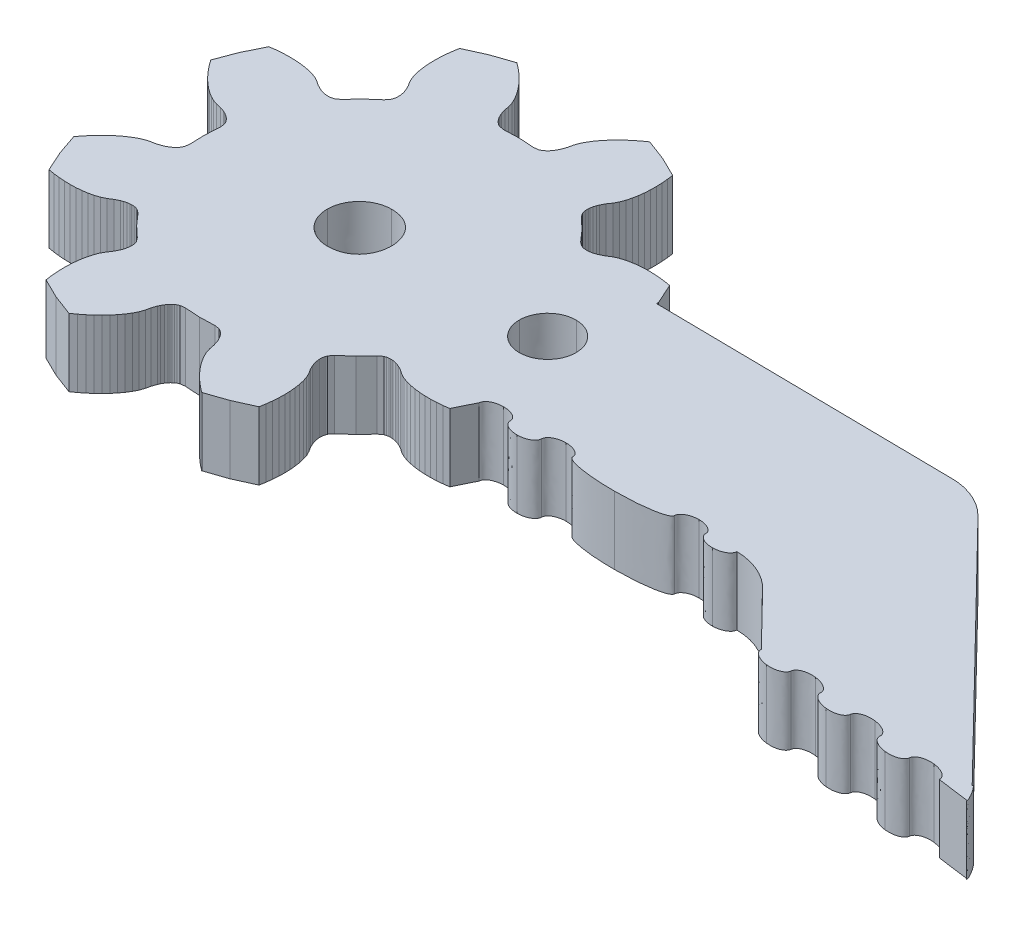
from build123d import *

# Parameters (mm, degrees)
BOSS_EXTRUDE1_DEPTH = 3.175


with BuildPart() as part:
    # Sketch1 → Boss-Extrude1 (new body)
    with BuildSketch(Plane(origin=(0, 0, 0), x_dir=(1, 0, 0), z_dir=(0, 1, 0))):
        with BuildLine():
            Line((118.534060584, 166.096137226), (118.534060584, 166.193037226))
            Line((118.534060584, 166.193037226), (118.108060584, 167.134537226))
            Line((118.108060584, 167.134537226), (117.826560584, 167.181137226))
            Line((117.826560584, 167.181137226), (117.549360584, 167.214137226))
            Line((117.549360584, 167.214137226), (117.276960584, 167.233637226))
            Line((117.276960584, 167.233637226), (117.010060584, 167.239237226))
            Line((117.010060584, 167.239237226), (116.749260584, 167.230937226))
            Line((116.749260584, 167.230937226), (116.495560584, 167.208237226))
            Line((116.495560584, 167.208237226), (116.249660584, 167.170437226))
            Line((116.249660584, 167.170437226), (116.013260584, 167.116437226))
            Line((116.013260584, 167.116437226), (115.788260584, 167.043537226))
            Line((115.788260584, 167.043537226), (115.582360584, 166.941537226))
            Line((115.582360584, 166.941537226), (115.390360584, 166.818437226))
            Line((115.390360584, 166.818437226), (115.183560584, 166.717437226))
            Line((115.183560584, 166.717437226), (115.073160584, 166.677237226))
            Line((115.073160584, 166.677237226), (114.956660584, 166.645637226))
            Line((114.956660584, 166.645637226), (114.832260584, 166.625337226))
            Line((114.832260584, 166.625337226), (114.765960584, 166.620637226))
            Line((114.765960584, 166.620637226), (114.695960584, 166.620837226))
            Line((114.695960584, 166.620837226), (114.621060584, 166.627637226))
            Line((114.621060584, 166.627637226), (114.538460584, 166.644337226))
            Line((114.538460584, 166.644337226), (114.441560584, 166.679237226))
            Line((114.441560584, 166.679237226), (114.261560584, 166.818637226))
            Line((114.261560584, 166.818637226), (113.795260584, 167.348437226))
            Line((113.795260584, 167.348437226), (113.280360584, 167.831137226))
            Line((113.280360584, 167.831137226), (113.146760584, 168.015437226))
            Line((113.146760584, 168.015437226), (113.114860584, 168.113337226))
            Line((113.114860584, 168.113337226), (113.100760584, 168.196437226))
            Line((113.100760584, 168.196437226), (113.096260584, 168.271637226))
            Line((113.096260584, 168.271637226), (113.098260584, 168.341537226))
            Line((113.098260584, 168.341537226), (113.105060584, 168.407637226))
            Line((113.105060584, 168.407637226), (113.129260584, 168.531337226))
            Line((113.129260584, 168.531337226), (113.164460584, 168.646837226))
            Line((113.164460584, 168.646837226), (113.208160584, 168.755937226))
            Line((113.208160584, 168.755937226), (113.315660584, 168.959437226))
            Line((113.315660584, 168.959437226), (113.444660584, 169.147437226))
            Line((113.444660584, 169.147437226), (113.553160584, 169.350037226))
            Line((113.553160584, 169.350037226), (113.632960584, 169.572637226))
            Line((113.632960584, 169.572637226), (113.694460584, 169.807237226))
            Line((113.694460584, 169.807237226), (113.739960584, 170.051737226))
            Line((113.739960584, 170.051737226), (113.770560584, 170.304737226))
            Line((113.770560584, 170.304737226), (113.787060584, 170.565037226))
            Line((113.787060584, 170.565037226), (113.789860584, 170.832037226))
            Line((113.789860584, 170.832037226), (113.778960584, 171.104937226))
            Line((113.778960584, 171.104937226), (113.754660584, 171.383037226))
            Line((113.754660584, 171.383037226), (113.716960584, 171.665837226))
            Line((113.716960584, 171.665837226), (112.789260584, 172.121237226))
            Line((112.789260584, 172.121237226), (111.822260584, 172.485737226))
            Line((111.822260584, 172.485737226), (111.590260584, 172.319637226))
            Line((111.590260584, 172.319637226), (111.370960584, 172.146937226))
            Line((111.370960584, 172.146937226), (111.164560584, 171.968137226))
            Line((111.164560584, 171.968137226), (110.971760584, 171.783337226))
            Line((110.971760584, 171.783337226), (110.793360584, 171.593037226))
            Line((110.793360584, 171.593037226), (110.629960584, 171.397537226))
            Line((110.629960584, 171.397537226), (110.482860584, 171.197037226))
            Line((110.482860584, 171.197037226), (110.353860584, 170.991637226))
            Line((110.353860584, 170.991637226), (110.246360584, 170.781037226))
            Line((110.246360584, 170.781037226), (110.172760584, 170.563337226))
            Line((110.172760584, 170.563337226), (110.124060584, 170.340537226))
            Line((110.124060584, 170.340537226), (110.049260584, 170.122837226))
            Line((110.049260584, 170.122837226), (109.999660584, 170.016337226))
            Line((109.999660584, 170.016337226), (109.939660584, 169.911637226))
            Line((109.939660584, 169.911637226), (109.866060584, 169.809237226))
            Line((109.866060584, 169.809237226), (109.822460584, 169.759037226))
            Line((109.822460584, 169.759037226), (109.772860584, 169.709737226))
            Line((109.772860584, 169.709737226), (109.714960584, 169.661537226))
            Line((109.714960584, 169.661537226), (109.644760584, 169.615037226))
            Line((109.644760584, 169.615037226), (109.551560584, 169.571237226))
            Line((109.551560584, 169.571237226), (109.325760584, 169.542437226))
            Line((109.325760584, 169.542437226), (108.621460584, 169.587337226))
            Line((108.621460584, 169.587337226), (107.916060584, 169.564637226))
            Line((107.916060584, 169.564637226), (107.691160584, 169.600437226))
            Line((107.691160584, 169.600437226), (107.599460584, 169.647137226))
            Line((107.599460584, 169.647137226), (107.530660584, 169.695937226))
            Line((107.530660584, 169.695937226), (107.474460584, 169.745937226))
            Line((107.474460584, 169.745937226), (107.426360584, 169.796737226))
            Line((107.426360584, 169.796737226), (107.384360584, 169.848237226))
            Line((107.384360584, 169.848237226), (107.314060584, 169.952937226))
            Line((107.314060584, 169.952937226), (107.257360584, 170.059437226))
            Line((107.257360584, 170.059437226), (107.211060584, 170.167437226))
            Line((107.211060584, 170.167437226), (107.143160584, 170.387337226))
            Line((107.143160584, 170.387337226), (107.101460584, 170.611537226))
            Line((107.101460584, 170.611537226), (107.034860584, 170.831537226))
            Line((107.034860584, 170.831537226), (106.933960584, 171.045337226))
            Line((106.933960584, 171.045337226), (106.811560584, 171.254737226))
            Line((106.811560584, 171.254737226), (106.670760584, 171.459737226))
            Line((106.670760584, 171.459737226), (106.513560584, 171.660337226))
            Line((106.513560584, 171.660337226), (106.341160584, 171.856037226))
            Line((106.341160584, 171.856037226), (106.154260584, 172.046737226))
            Line((106.154260584, 172.046737226), (105.953660584, 172.232037226))
            Line((105.953660584, 172.232037226), (105.739860584, 172.411537226))
            Line((105.739860584, 172.411537226), (105.513260584, 172.584837226))
            Line((105.513260584, 172.584837226), (104.535260584, 172.250837226))
            Line((104.535260584, 172.250837226), (103.593660584, 171.824837226))
            Line((103.593660584, 171.824837226), (103.547160584, 171.543337226))
            Line((103.547160584, 171.543337226), (103.514060584, 171.266137226))
            Line((103.514060584, 171.266137226), (103.494660584, 170.993737226))
            Line((103.494660584, 170.993737226), (103.488960584, 170.726837226))
            Line((103.488960584, 170.726837226), (103.497360584, 170.466137226))
            Line((103.497360584, 170.466137226), (103.519960584, 170.212237226))
            Line((103.519960584, 170.212237226), (103.557760584, 169.966537226))
            Line((103.557760584, 169.966537226), (103.611860584, 169.730037226))
            Line((103.611860584, 169.730037226), (103.684660584, 169.505137226))
            Line((103.684660584, 169.505137226), (103.786660584, 169.299137226))
            Line((103.786660584, 169.299137226), (103.909860584, 169.107137226))
            Line((103.909860584, 169.107137226), (104.010760584, 168.900337226))
            Line((104.010760584, 168.900337226), (104.051060584, 168.789937226))
            Line((104.051060584, 168.789937226), (104.082560584, 168.673537226))
            Line((104.082560584, 168.673537226), (104.102960584, 168.549037226))
            Line((104.102960584, 168.549037226), (104.107660584, 168.482737226))
            Line((104.107660584, 168.482737226), (104.107460584, 168.412737226))
            Line((104.107460584, 168.412737226), (104.100560584, 168.337837226))
            Line((104.100560584, 168.337837226), (104.083860584, 168.255237226))
            Line((104.083860584, 168.255237226), (104.048960584, 168.158337226))
            Line((104.048960584, 168.158337226), (103.909560584, 167.978337226))
            Line((103.909560584, 167.978337226), (103.379860584, 167.512037226))
            Line((103.379860584, 167.512037226), (102.897160584, 166.997137226))
            Line((102.897160584, 166.997137226), (102.712860584, 166.863537226))
            Line((102.712860584, 166.863537226), (102.614860584, 166.831637226))
            Line((102.614860584, 166.831637226), (102.531760584, 166.817537226))
            Line((102.531760584, 166.817537226), (102.456660584, 166.813137226))
            Line((102.456660584, 166.813137226), (102.386760584, 166.815037226))
            Line((102.386760584, 166.815037226), (102.320660584, 166.821837226))
            Line((102.320660584, 166.821837226), (102.196860584, 166.846137226))
            Line((102.196860584, 166.846137226), (102.081460584, 166.881337226))
            Line((102.081460584, 166.881337226), (101.972360584, 166.924937226))
            Line((101.972360584, 166.924937226), (101.768860584, 167.032437226))
            Line((101.768860584, 167.032437226), (101.580860584, 167.161537226))
            Line((101.580860584, 167.161537226), (101.378160584, 167.269937226))
            Line((101.378160584, 167.269937226), (101.155660584, 167.349837226))
            Line((101.155660584, 167.349837226), (100.920960584, 167.411237226))
            Line((100.920960584, 167.411237226), (100.676460584, 167.456737226))
            Line((100.676460584, 167.456737226), (100.423560584, 167.487437226))
            Line((100.423560584, 167.487437226), (100.163160584, 167.503937226))
            Line((100.163160584, 167.503937226), (99.896260584, 167.506637226))
            Line((99.896260584, 167.506637226), (99.623360584, 167.495737226))
            Line((99.623360584, 167.495737226), (99.345260584, 167.471437226))
            Line((99.345260584, 167.471437226), (99.062460584, 167.433737226))
            Line((99.062460584, 167.433737226), (98.607060584, 166.506037226))
            Line((98.607060584, 166.506037226), (98.242560584, 165.539037226))
            Line((98.242560584, 165.539037226), (98.408660584, 165.307137226))
            Line((98.408660584, 165.307137226), (98.581260584, 165.087737226))
            Line((98.581260584, 165.087737226), (98.760160584, 164.881337226))
            Line((98.760160584, 164.881337226), (98.944860584, 164.688637226))
            Line((98.944860584, 164.688637226), (99.135160584, 164.510137226))
            Line((99.135160584, 164.510137226), (99.330660584, 164.346737226))
            Line((99.330660584, 164.346737226), (99.531160584, 164.199637226))
            Line((99.531160584, 164.199637226), (99.736660584, 164.070637226))
            Line((99.736660584, 164.070637226), (99.947160584, 163.963137226))
            Line((99.947160584, 163.963137226), (100.164960584, 163.889537226))
            Line((100.164960584, 163.889537226), (100.387760584, 163.840937226))
            Line((100.387760584, 163.840937226), (100.605360584, 163.766137226))
            Line((100.605360584, 163.766137226), (100.711860584, 163.716537226))
            Line((100.711860584, 163.716537226), (100.816560584, 163.656437226))
            Line((100.816560584, 163.656437226), (100.918960584, 163.582837226))
            Line((100.918960584, 163.582837226), (100.969160584, 163.539237226))
            Line((100.969160584, 163.539237226), (101.018460584, 163.489637226))
            Line((101.018460584, 163.489637226), (101.066660584, 163.431837226))
            Line((101.066660584, 163.431837226), (101.113260584, 163.361537226))
            Line((101.113260584, 163.361537226), (101.157060584, 163.268337226))
            Line((101.157060584, 163.268337226), (101.185760584, 163.042537226))
            Line((101.185760584, 163.042537226), (101.140860584, 162.338237226))
            Line((101.140860584, 162.338237226), (101.163660584, 161.632837226))
            Line((101.163660584, 161.632837226), (101.127860584, 161.408037226))
            Line((101.127860584, 161.408037226), (101.081160584, 161.316237226))
            Line((101.081160584, 161.316237226), (101.032360584, 161.247537226))
            Line((101.032360584, 161.247537226), (100.982360584, 161.191237226))
            Line((100.982360584, 161.191237226), (100.931560584, 161.143137226))
            Line((100.931560584, 161.143137226), (100.879960584, 161.101237226))
            Line((100.879960584, 161.101237226), (100.775260584, 161.030837226))
            Line((100.775260584, 161.030837226), (100.668860584, 160.974137226))
            Line((100.668860584, 160.974137226), (100.560760584, 160.927837226))
            Line((100.560760584, 160.927837226), (100.340960584, 160.859937226))
            Line((100.340960584, 160.859937226), (100.116660584, 160.818337226))
            Line((100.116660584, 160.818337226), (99.896760584, 160.751637226))
            Line((99.896760584, 160.751637226), (99.682860584, 160.650737226))
            Line((99.682860584, 160.650737226), (99.473560584, 160.528337226))
            Line((99.473560584, 160.528337226), (99.268460584, 160.387637226))
            Line((99.268460584, 160.387637226), (99.067960584, 160.230437226))
            Line((99.067960584, 160.230437226), (98.872160584, 160.057937226))
            Line((98.872160584, 160.057937226), (98.681460584, 159.871137226))
            Line((98.681460584, 159.871137226), (98.496160584, 159.670437226))
            Line((98.496160584, 159.670437226), (98.316660584, 159.456637226))
            Line((98.316660584, 159.456637226), (98.143460584, 159.230037226))
            Line((98.143460584, 159.230037226), (98.477360584, 158.252037226))
            Line((98.477360584, 158.252037226), (98.903360584, 157.310437226))
            Line((98.903360584, 157.310437226), (99.184860584, 157.263937226))
            Line((99.184860584, 157.263937226), (99.462060584, 157.230837226))
            Line((99.462060584, 157.230837226), (99.734460584, 157.211437226))
            Line((99.734460584, 157.211437226), (100.001460584, 157.205837226))
            Line((100.001460584, 157.205837226), (100.262160584, 157.214137226))
            Line((100.262160584, 157.214137226), (100.515960584, 157.236837226))
            Line((100.515960584, 157.236837226), (100.761760584, 157.274537226))
            Line((100.761760584, 157.274537226), (100.998260584, 157.328637226))
            Line((100.998260584, 157.328637226), (101.223160584, 157.401537226))
            Line((101.223160584, 157.401537226), (101.429160584, 157.503537226))
            Line((101.429160584, 157.503537226), (101.621060584, 157.626637226))
            Line((101.621060584, 157.626637226), (101.827860584, 157.727637226))
            Line((101.827860584, 157.727637226), (101.938260584, 157.767837226))
            Line((101.938260584, 157.767837226), (102.054760584, 157.799437226))
            Line((102.054760584, 157.799437226), (102.179260584, 157.819737226))
            Line((102.179260584, 157.819737226), (102.245460584, 157.824437226))
            Line((102.245460584, 157.824437226), (102.315460584, 157.824237226))
            Line((102.315460584, 157.824237226), (102.390460584, 157.817437226))
            Line((102.390460584, 157.817437226), (102.473060584, 157.800737226))
            Line((102.473060584, 157.800737226), (102.569860584, 157.765737226))
            Line((102.569860584, 157.765737226), (102.749860584, 157.626437226))
            Line((102.749860584, 157.626437226), (103.216260584, 157.096637226))
            Line((103.216260584, 157.096637226), (103.731060584, 156.613937226))
            Line((103.731060584, 156.613937226), (103.864760584, 156.429637226))
            Line((103.864760584, 156.429637226), (103.896560584, 156.331737226))
            Line((103.896560584, 156.331737226), (103.910660584, 156.248637226))
            Line((103.910660584, 156.248637226), (103.915160584, 156.173437226))
            Line((103.915160584, 156.173437226), (103.913160584, 156.103537226))
            Line((103.913160584, 156.103537226), (103.906460584, 156.037437226))
            Line((103.906460584, 156.037437226), (103.882160584, 155.913637226))
            Line((103.882160584, 155.913637226), (103.846960584, 155.798237226))
            Line((103.846960584, 155.798237226), (103.803260584, 155.689137226))
            Line((103.803260584, 155.689137226), (103.695860584, 155.485637226))
            Line((103.695860584, 155.485637226), (103.566760584, 155.297637226))
            Line((103.566760584, 155.297637226), (103.458360584, 155.094937226))
            Line((103.458360584, 155.094937226), (103.378460584, 154.872437226))
            Line((103.378460584, 154.872437226), (103.316960584, 154.637837226))
            Line((103.316960584, 154.637837226), (103.271460584, 154.393337226))
            Line((103.271460584, 154.393337226), (103.240860584, 154.140337226))
            Line((103.240860584, 154.140337226), (103.224360584, 153.879937226))
            Line((103.224360584, 153.879937226), (103.221660584, 153.613037226))
            Line((103.221660584, 153.613037226), (103.232460584, 153.340137226))
            Line((103.232460584, 153.340137226), (103.256760584, 153.062037226))
            Line((103.256760584, 153.062037226), (103.294460584, 152.779237226))
            Line((103.294460584, 152.779237226), (104.222160584, 152.323837226))
            Line((104.222160584, 152.323837226), (105.189160584, 151.959337226))
            Line((105.189160584, 151.959337226), (105.421160584, 152.125437226))
            Line((105.421160584, 152.125437226), (105.640560584, 152.298037226))
            Line((105.640560584, 152.298037226), (105.846860584, 152.476937226))
            Line((105.846860584, 152.476937226), (106.039660584, 152.661737226))
            Line((106.039660584, 152.661737226), (106.218160584, 152.851937226))
            Line((106.218160584, 152.851937226), (106.381560584, 153.047437226))
            Line((106.381560584, 153.047437226), (106.528660584, 153.248037226))
            Line((106.528660584, 153.248037226), (106.657560584, 153.453437226))
            Line((106.657560584, 153.453437226), (106.765160584, 153.663937226))
            Line((106.765160584, 153.663937226), (106.838660584, 153.881737226))
            Line((106.838660584, 153.881737226), (106.887360584, 154.104537226))
            Line((106.887360584, 154.104537226), (106.962160584, 154.322137226))
            Line((106.962160584, 154.322137226), (107.011760584, 154.428637226))
            Line((107.011760584, 154.428637226), (107.071860584, 154.533337226))
            Line((107.071860584, 154.533337226), (107.145460584, 154.635837226))
            Line((107.145460584, 154.635837226), (107.188960584, 154.685937226))
            Line((107.188960584, 154.685937226), (107.238560584, 154.735237226))
            Line((107.238560584, 154.735237226), (107.296460584, 154.783437226))
            Line((107.296460584, 154.783437226), (107.366660584, 154.830037226))
            Line((107.366660584, 154.830037226), (107.459860584, 154.873837226))
            Line((107.459860584, 154.873837226), (107.685660584, 154.902637226))
            Line((107.685660584, 154.902637226), (108.390060584, 154.857737226))
            Line((108.390060584, 154.857737226), (109.095460584, 154.880437226))
            Line((109.095460584, 154.880437226), (109.320260584, 154.844637226))
            Line((109.320260584, 154.844637226), (109.412060584, 154.797937226))
            Line((109.412060584, 154.797937226), (109.480760584, 154.749137226))
            Line((109.480760584, 154.749137226), (109.537060584, 154.699137226))
            Line((109.537060584, 154.699137226), (109.585060584, 154.648337226))
            Line((109.585060584, 154.648337226), (109.627060584, 154.596837226))
            Line((109.627060584, 154.596837226), (109.697360584, 154.492137226))
            Line((109.697360584, 154.492137226), (109.754160584, 154.385637226))
            Line((109.754160584, 154.385637226), (109.800360584, 154.277537226))
            Line((109.800360584, 154.277537226), (109.868360584, 154.057737226))
            Line((109.868360584, 154.057737226), (109.909960584, 153.833537226))
            Line((109.909960584, 153.833537226), (109.976660584, 153.613537226))
            Line((109.976660584, 153.613537226), (110.077460584, 153.399737226))
            Line((110.077460584, 153.399737226), (110.199960584, 153.190337226))
            Line((110.199960584, 153.190337226), (110.340660584, 152.985237226))
            Line((110.340660584, 152.985237226), (110.497860584, 152.784737226))
            Line((110.497860584, 152.784737226), (110.670260584, 152.588937226))
            Line((110.670260584, 152.588937226), (110.857160584, 152.398237226))
            Line((110.857160584, 152.398237226), (111.057760584, 152.213037226))
            Line((111.057760584, 152.213037226), (111.271660584, 152.033537226))
            Line((111.271660584, 152.033537226), (111.498260584, 151.860237226))
            Line((111.498260584, 151.860237226), (112.476260584, 152.194137226))
            Line((112.476260584, 152.194137226), (113.417760584, 152.620237226))
            Line((113.417760584, 152.620237226), (113.464360584, 152.901637226))
            Line((113.464360584, 152.901637226), (113.497360584, 153.178937226))
            Line((113.497360584, 153.178937226), (113.516760584, 153.451337226))
            Line((113.516760584, 153.451337226), (113.522460584, 153.718237226))
            Line((113.522460584, 153.718237226), (113.514160584, 153.978937226))
            Line((113.514160584, 153.978937226), (113.491460584, 154.232737226))
            Line((113.491460584, 154.232737226), (113.453660584, 154.478537226))
            Line((113.453660584, 154.478537226), (113.399560584, 154.715037226))
            Line((113.399560584, 154.715037226), (113.326760584, 154.939937226))
            Line((113.326760584, 154.939937226), (113.224760584, 155.145937226))
            Line((113.224760584, 155.145937226), (113.101660584, 155.337837226))
            Line((113.101660584, 155.337837226), (113.000660584, 155.544637226))
            Line((113.000660584, 155.544637226), (112.960360584, 155.655037226))
            Line((112.960360584, 155.655037226), (112.928860584, 155.771537226))
            Line((112.928860584, 155.771537226), (112.908460584, 155.896037226))
            Line((112.908460584, 155.896037226), (112.903760584, 155.962337226))
            Line((112.903760584, 155.962337226), (112.904060584, 156.032237226))
            Line((112.904060584, 156.032237226), (112.910860584, 156.107237226))
            Line((112.910860584, 156.107237226), (112.927560584, 156.189837226))
            Line((112.927560584, 156.189837226), (112.962460584, 156.286637226))
            Line((112.962460584, 156.286637226), (113.101860584, 156.466737226))
            Line((113.101860584, 156.466737226), (113.631560584, 156.933037226))
            Line((113.631560584, 156.933037226), (114.114360584, 157.447837226))
            Line((114.114360584, 157.447837226), (114.298660584, 157.581537226))
            Line((114.298660584, 157.581537226), (114.396560584, 157.613337226))
            Line((114.396560584, 157.613337226), (114.479660584, 157.627537226))
            Line((114.479660584, 157.627537226), (114.554760584, 157.631937226))
            Line((114.554760584, 157.631937226), (114.624660584, 157.630037226))
            Line((114.624660584, 157.630037226), (114.690760584, 157.623237226))
            Line((114.690760584, 157.623237226), (114.814560584, 157.598937226))
            Line((114.814560584, 157.598937226), (114.930060584, 157.563737226))
            Line((114.930060584, 157.563737226), (115.039160584, 157.520037226))
            Line((115.039160584, 157.520037226), (115.242560584, 157.412637226))
            Line((115.242560584, 157.412637226), (115.430660584, 157.283537226))
            Line((115.430660584, 157.283537226), (115.633260584, 157.175137226))
            Line((115.633260584, 157.175137226), (115.855760584, 157.095237226))
            Line((115.855760584, 157.095237226), (116.090460584, 157.033737226))
            Line((116.090460584, 157.033737226), (116.334960584, 156.988337226))
            Line((116.334960584, 156.988337226), (116.587860584, 156.957637226))
            Line((116.587860584, 156.957637226), (116.848260584, 156.941137226))
            Line((116.848260584, 156.941137226), (117.115260584, 156.938437226))
            Line((117.115260584, 156.938437226), (117.388060584, 156.949237226))
            Line((117.388060584, 156.949237226), (117.666260584, 156.973637226))
            Line((117.666260584, 156.973637226), (117.948960584, 157.011237226))
            Line((117.948960584, 157.011237226), (118.404460584, 157.938937226))
            Line((118.404460584, 157.938937226), (118.404460584, 157.925837226))
            add(Edge.make_bspline(
                [(118.404460584, 157.925837226), (118.407660584, 158.153937226), (118.736960584, 158.338837226), (119.139860584, 158.338837226)],
                knots=[0.902506964, 0.902506964, 0.902506964, 0.902506964, 0.905292479, 0.905292479, 0.905292479, 0.905292479], degree=3))
            add(Edge.make_bspline(
                [(119.139860584, 158.338837226), (119.542860584, 158.338837226), (119.866860584, 158.153937226), (119.863760584, 157.925837226)],
                knots=[0.905292479, 0.905292479, 0.905292479, 0.905292479, 0.908077994, 0.908077994, 0.908077994, 0.908077994], degree=3))
            add(Edge.make_bspline(
                [(119.863760584, 157.925837226), (119.860560584, 157.697737226), (120.184560584, 157.512837226), (120.587560584, 157.512837226)],
                knots=[0.908077994, 0.908077994, 0.908077994, 0.908077994, 0.91086351, 0.91086351, 0.91086351, 0.91086351], degree=3))
            add(Edge.make_bspline(
                [(120.587560584, 157.512837226), (120.990460584, 157.512837226), (121.319760584, 157.697737226), (121.323060584, 157.925837226)],
                knots=[0.91086351, 0.91086351, 0.91086351, 0.91086351, 0.913649025, 0.913649025, 0.913649025, 0.913649025], degree=3))
            add(Edge.make_bspline(
                [(121.323060584, 157.925837226), (121.326260584, 158.153937226), (121.655460584, 158.338837226), (122.058460584, 158.338837226)],
                knots=[0.913649025, 0.913649025, 0.913649025, 0.913649025, 0.91643454, 0.91643454, 0.91643454, 0.91643454], degree=3))
            add(Edge.make_bspline(
                [(122.058460584, 158.338837226), (122.461360584, 158.338837226), (122.785460584, 158.153937226), (122.782460584, 157.925837226)],
                knots=[0.91643454, 0.91643454, 0.91643454, 0.91643454, 0.919220056, 0.919220056, 0.919220056, 0.919220056], degree=3))
            add(Edge.make_bspline(
                [(122.782460584, 157.925837226), (122.772160584, 157.697637226), (123.829060584, 157.512737226), (125.143160584, 157.512737226)],
                knots=[0.919220056, 0.919220056, 0.919220056, 0.919220056, 0.922005571, 0.922005571, 0.922005571, 0.922005571], degree=3))
            add(Edge.make_bspline(
                [(125.143160584, 157.512737226), (126.457260584, 157.512737226), (127.531060584, 157.697637226), (127.541560584, 157.925837226)],
                knots=[0.922005571, 0.922005571, 0.922005571, 0.922005571, 0.924791086, 0.924791086, 0.924791086, 0.924791086], degree=3))
            add(Edge.make_bspline(
                [(127.541560584, 157.925837226), (127.544760584, 158.153837226), (127.873960584, 158.338737226), (128.276960584, 158.338737226)],
                knots=[0.924791086, 0.924791086, 0.924791086, 0.924791086, 0.927576602, 0.927576602, 0.927576602, 0.927576602], degree=3))
            add(Edge.make_bspline(
                [(128.276960584, 158.338737226), (128.679860584, 158.338737226), (129.003960584, 158.153837226), (129.000760584, 157.925737226)],
                knots=[0.927576602, 0.927576602, 0.927576602, 0.927576602, 0.930362117, 0.930362117, 0.930362117, 0.930362117], degree=3))
            add(Edge.make_bspline(
                [(129.000760584, 157.925737226), (128.997560584, 157.697637226), (129.321660584, 157.512737226), (129.724560584, 157.512737226)],
                knots=[0.930362117, 0.930362117, 0.930362117, 0.930362117, 0.933147632, 0.933147632, 0.933147632, 0.933147632], degree=3))
            add(Edge.make_bspline(
                [(129.724560584, 157.512737226), (130.127560584, 157.512737226), (130.456760584, 157.697637226), (130.459960584, 157.925737226)],
                knots=[0.933147632, 0.933147632, 0.933147632, 0.933147632, 0.935933148, 0.935933148, 0.935933148, 0.935933148], degree=3))
            add(Edge.make_bspline(
                [(130.459960584, 157.925737226), (131.255560584, 157.915837226), (132.014660584, 157.590237226), (132.570260584, 157.020737226)],
                knots=[0.935933148, 0.935933148, 0.935933148, 0.935933148, 0.938718663, 0.938718663, 0.938718663, 0.938718663], degree=3))
            Line((132.570260584, 157.020737226), (134.988060584, 154.541837226))
            add(Edge.make_bspline(
                [(134.988060584, 154.541837226), (134.964860584, 154.314837226), (135.298060584, 154.089537226), (135.732260584, 154.038337226)],
                knots=[0.941504178, 0.941504178, 0.941504178, 0.941504178, 0.944289694, 0.944289694, 0.944289694, 0.944289694], degree=3))
            add(Edge.make_bspline(
                [(135.732260584, 154.038337226), (136.166560584, 153.987237226), (136.537360584, 154.129837226), (136.560660584, 154.356737226)],
                knots=[0.944289694, 0.944289694, 0.944289694, 0.944289694, 0.947075209, 0.947075209, 0.947075209, 0.947075209], degree=3))
            add(Edge.make_bspline(
                [(136.560660584, 154.356737226), (136.583860584, 154.583737226), (136.954660584, 154.726237226), (137.388860584, 154.675137226)],
                knots=[0.947075209, 0.947075209, 0.947075209, 0.947075209, 0.949860724, 0.949860724, 0.949860724, 0.949860724], degree=3))
            add(Edge.make_bspline(
                [(137.388860584, 154.675137226), (137.823160584, 154.624037226), (138.156360584, 154.398637226), (138.133260584, 154.171737226)],
                knots=[0.949860724, 0.949860724, 0.949860724, 0.949860724, 0.95264624, 0.95264624, 0.95264624, 0.95264624], degree=3))
            add(Edge.make_bspline(
                [(138.133260584, 154.171737226), (138.109960584, 153.944837226), (138.443160584, 153.719437226), (138.877460584, 153.668337226)],
                knots=[0.95264624, 0.95264624, 0.95264624, 0.95264624, 0.955431755, 0.955431755, 0.955431755, 0.955431755], degree=3))
            add(Edge.make_bspline(
                [(138.877460584, 153.668337226), (139.311660584, 153.617237226), (139.682560584, 153.759737226), (139.705760584, 153.986737226)],
                knots=[0.955431755, 0.955431755, 0.955431755, 0.955431755, 0.95821727, 0.95821727, 0.95821727, 0.95821727], degree=3))
            add(Edge.make_bspline(
                [(139.705760584, 153.986737226), (139.728960584, 154.213637226), (140.099860584, 154.356137226), (140.534060584, 154.305037226)],
                knots=[0.95821727, 0.95821727, 0.95821727, 0.95821727, 0.961002786, 0.961002786, 0.961002786, 0.961002786], degree=3))
            add(Edge.make_bspline(
                [(140.534060584, 154.305037226), (140.968360584, 154.253937226), (141.301560584, 154.028537226), (141.278360584, 153.801637226)],
                knots=[0.961002786, 0.961002786, 0.961002786, 0.961002786, 0.963788301, 0.963788301, 0.963788301, 0.963788301], degree=3))
            add(Edge.make_bspline(
                [(141.278360584, 153.801637226), (141.255160584, 153.574737226), (141.588360584, 153.349337226), (142.022660584, 153.298237226)],
                knots=[0.963788301, 0.963788301, 0.963788301, 0.963788301, 0.966573816, 0.966573816, 0.966573816, 0.966573816], degree=3))
            add(Edge.make_bspline(
                [(142.022660584, 153.298237226), (142.456860584, 153.247137226), (142.827660584, 153.389637226), (142.850960584, 153.616637226)],
                knots=[0.966573816, 0.966573816, 0.966573816, 0.966573816, 0.969359331, 0.969359331, 0.969359331, 0.969359331], degree=3))
            add(Edge.make_bspline(
                [(142.850960584, 153.616637226), (142.874160584, 153.843537226), (143.244960584, 153.986137226), (143.679260584, 153.935037226)],
                knots=[0.969359331, 0.969359331, 0.969359331, 0.969359331, 0.972144847, 0.972144847, 0.972144847, 0.972144847], degree=3))
            add(Edge.make_bspline(
                [(143.679260584, 153.935037226), (144.113460584, 153.883837226), (144.446660584, 153.658537226), (144.423460584, 153.431537226)],
                knots=[0.972144847, 0.972144847, 0.972144847, 0.972144847, 0.974930362, 0.974930362, 0.974930362, 0.974930362], degree=3))
            Line((144.423460584, 153.431537226), (145.927960584, 153.229037226))
            Line((145.927960584, 153.229037226), (145.927660584, 153.201737226))
            add(Edge.make_bspline(
                [(145.927660584, 153.201737226), (145.994760584, 153.200937226), (145.710660584, 153.736537226), (145.478060584, 153.975037226)],
                knots=[0.980501393, 0.980501393, 0.980501393, 0.980501393, 0.983286908, 0.983286908, 0.983286908, 0.983286908], degree=3))
            Line((145.478060584, 153.975037226), (145.431960584, 153.961237226))
            Line((145.431960584, 153.961237226), (134.669860584, 164.995137226))
            Line((134.669860584, 164.995137226), (134.666360584, 164.996637226))
            add(Edge.make_bspline(
                [(134.666360584, 164.996637226), (134.114060584, 165.569437226), (133.356860584, 165.899337226), (132.561360584, 165.913837226)],
                knots=[0.991643454, 0.991643454, 0.991643454, 0.991643454, 0.994428969, 0.994428969, 0.994428969, 0.994428969], degree=3))
            Line((132.561360584, 165.913837226), (118.534060584, 166.096137226))
        make_face()
        with BuildLine():
            add(Edge.make_bspline(
                [(108.516060584, 163.722537226), (107.681960584, 163.722537226), (107.005960584, 163.050837226), (107.005960584, 162.222537226)],
                knots=[0, 0, 0, 0, 0.25, 0.25, 0.25, 0.25], degree=3))
            add(Edge.make_bspline(
                [(107.005960584, 162.222537226), (107.005860584, 161.394037226), (107.681960584, 160.722537226), (108.515960584, 160.722537226)],
                knots=[0.25, 0.25, 0.25, 0.25, 0.5, 0.5, 0.5, 0.5], degree=3))
            add(Edge.make_bspline(
                [(108.515960584, 160.722537226), (110.502360584, 160.722537226), (110.502260584, 163.722537226), (108.516060584, 163.722537226)],
                knots=[0.5, 0.5, 0.5, 0.5, 1, 1, 1, 1], degree=3))
        make_face(mode=Mode.SUBTRACT)
        with BuildLine():
            add(Edge.make_bspline(
                [(118.640160584, 162.206037226), (118.649260584, 162.937637226), (118.063460584, 163.538237226), (117.331860584, 163.547337226)],
                knots=[0, 0, 0, 0, 0.2, 0.2, 0.2, 0.2], degree=3))
            add(Edge.make_bspline(
                [(117.331860584, 163.547337226), (116.600160584, 163.556437226), (115.999660584, 162.970737226), (115.990560584, 162.239137226)],
                knots=[0.2, 0.2, 0.2, 0.2, 0.4, 0.4, 0.4, 0.4], degree=3))
            add(Edge.make_bspline(
                [(115.990560584, 162.239137226), (115.981260584, 161.507337226), (116.567160584, 160.906937226), (117.298760584, 160.897837226)],
                knots=[0.4, 0.4, 0.4, 0.4, 0.6, 0.6, 0.6, 0.6], degree=3))
            add(Edge.make_bspline(
                [(117.298760584, 160.897837226), (118.030460584, 160.888737226), (118.630960584, 161.474337226), (118.640160584, 162.206037226)],
                knots=[0.6, 0.6, 0.6, 0.6, 1, 1, 1, 1], degree=3))
        make_face(mode=Mode.SUBTRACT)
    extrude(amount=BOSS_EXTRUDE1_DEPTH)


solid = part.part
